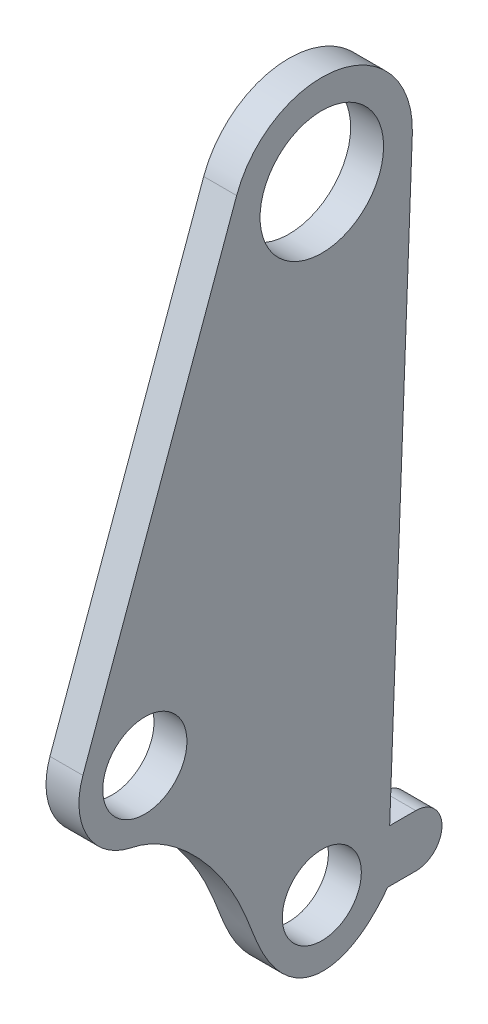
from build123d import *

# Parameters (mm, degrees)
SKETCH1_R           = 4.7625
SKETCH1_R_2         = 3.24612
SKETCH1_R_3         = 3.048
BOSS_EXTRUDE1_DEPTH = 2.54


with BuildPart() as part:
    # Sketch1 → Boss-Extrude1 (new body)
    with BuildSketch(Plane(origin=(0, 0, 0), x_dir=(0, 0, -1), z_dir=(1, 0, 0))):
        with BuildLine():
            Line((-6.569022954, 2.374481507), (-18.423755902, -30.421736365))
            ThreePointArc((-18.423755902, -30.421736365), (-18.07845445, -34.631024194), (-14.669645238, -37.124487022))
            add(Edge.make_bspline(
                [(-14.669645238, -37.124487022), (-11.315746, -37.814267622), (-6.920874402, -42.715545966), (-3.149468295, -54.175396606), (2.01655163, -53.801646181), (5.076228822, -49.6443)],
                knots=[0, 0, 0, 0, 0.321172829, 0.421172829, 1, 1, 1, 1], degree=3))
            Line((5.076228822, -49.6443), (7.24445656, -49.6443))
            ThreePointArc((7.24445656, -49.6443), (9.26375656, -47.625), (7.24445656, -45.6057))
            Line((7.24445656, -45.6057), (5.231930896, -45.6057))
            Line((5.231930896, -45.6057), (6.97981463, -0.269096126))
            ThreePointArc((6.97981463, -0.269096126), (1.337652095, 6.855721105), (-6.569022954, 2.374481507))
        make_face()
        Circle(SKETCH1_R, mode=Mode.SUBTRACT)
        with Locations((-13.646284662, -32.148632007)):
            Circle(SKETCH1_R_2, mode=Mode.SUBTRACT)
        with Locations((0, -47.625)):
            Circle(SKETCH1_R_3, mode=Mode.SUBTRACT)
    extrude(amount=BOSS_EXTRUDE1_DEPTH)


solid = part.part
